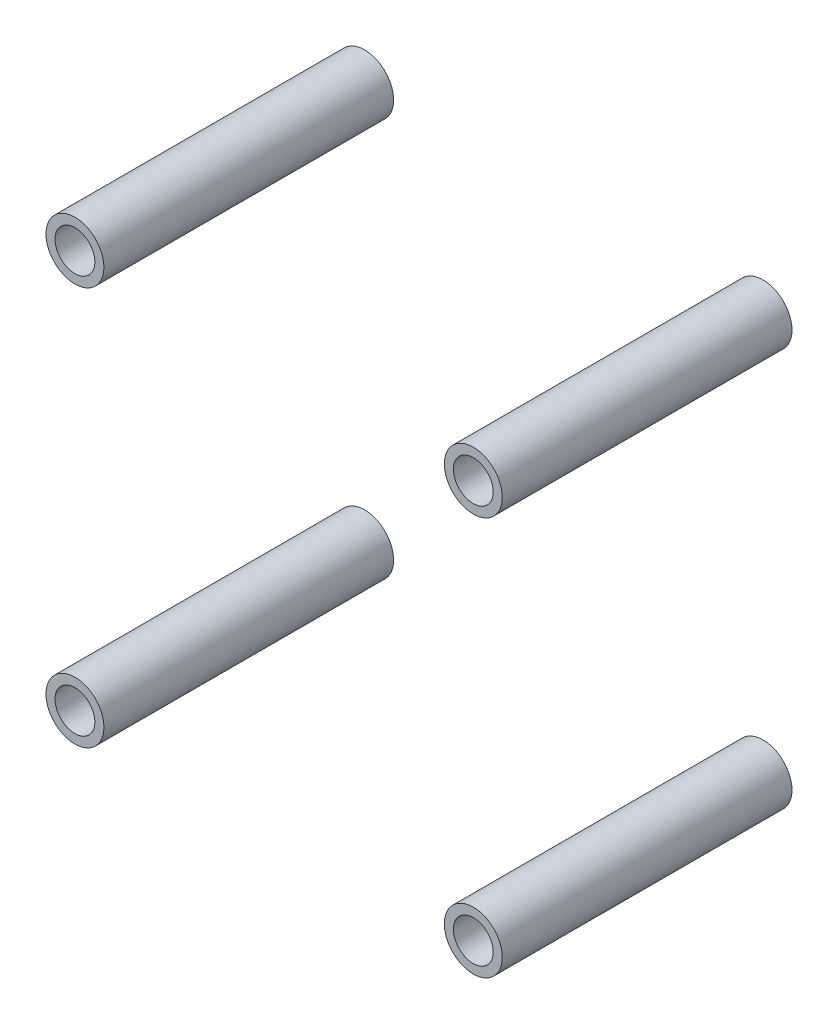
from build123d import *

# Parameters (mm, degrees)
SKETCH1_R             = 4
SKETCH1_R_2           = 2.75
BOSS_EXTRUDE1_DEPTH   = 40
BOSS_EXTRUDE1_2_DEPTH = 40
BOSS_EXTRUDE1_3_DEPTH = 40
BOSS_EXTRUDE1_4_DEPTH = 40


with BuildPart() as part:
    # Sketch1 → Boss-Extrude1 (new body)
    with BuildSketch(Plane.XY.offset(111.125)):
        with Locations((27.5, 306.9)):
            Circle(SKETCH1_R)
        with Locations((27.5, 306.9)):
            Circle(SKETCH1_R_2, mode=Mode.SUBTRACT)
    extrude(amount=BOSS_EXTRUDE1_DEPTH)


with BuildPart() as body_2:
    # Sketch1 → Boss-Extrude1 2 (new body)
    with BuildSketch(Plane.XY.offset(111.125)):
        with Locations((-27.5, 306.9)):
            Circle(SKETCH1_R)
        with Locations((-27.5, 306.9)):
            Circle(SKETCH1_R_2, mode=Mode.SUBTRACT)
    extrude(amount=BOSS_EXTRUDE1_2_DEPTH)


with BuildPart() as body_3:
    # Sketch1 → Boss-Extrude1 3 (new body)
    with BuildSketch(Plane.XY.offset(111.125)):
        with Locations((-27.5, 251.9)):
            Circle(SKETCH1_R)
        with Locations((-27.5, 251.9)):
            Circle(SKETCH1_R_2, mode=Mode.SUBTRACT)
    extrude(amount=BOSS_EXTRUDE1_3_DEPTH)


with BuildPart() as body_4:
    # Sketch1 → Boss-Extrude1 4 (new body)
    with BuildSketch(Plane.XY.offset(111.125)):
        with Locations((27.5, 251.9)):
            Circle(SKETCH1_R)
        with Locations((27.5, 251.9)):
            Circle(SKETCH1_R_2, mode=Mode.SUBTRACT)
    extrude(amount=BOSS_EXTRUDE1_4_DEPTH)


solid = Compound([part.part, body_2.part, body_3.part, body_4.part])
